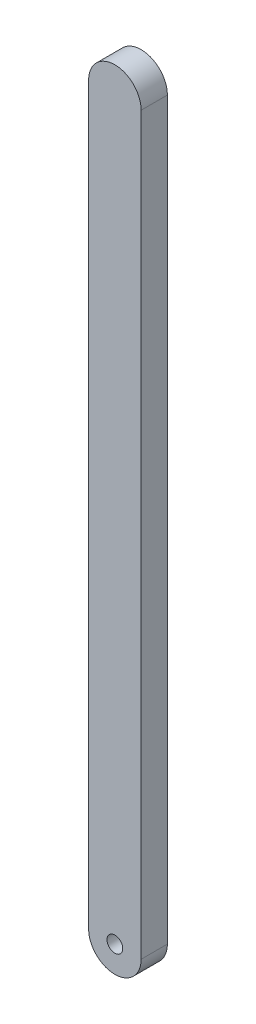
from build123d import *

# Parameters (mm, degrees)
ESQUISSE1_W             = 10
ESQUISSE1_H             = 150
BOSS_EXTRU_1_DEPTH      = 5
CONG_1_RADIUS           = 5
CONG_1_LENGTH           = 5
CONG_2_RADIUS           = 5
CONG_2_LENGTH           = 5
ESQUISSE2_R             = 2.5
ESQUISSE2_R_2           = 1.5
ENL_V_MAT_EXTRU_1_DEPTH = 76.332595867
ESQUISSE3_R             = 2.5
BOSS_EXTRU_2_DEPTH      = 2.5


with BuildPart() as part:
    # Esquisse1 → Boss.-Extru.1 (new body)
    with BuildSketch(Plane.XY):
        Rectangle(ESQUISSE1_W, ESQUISSE1_H)
    extrude(amount=BOSS_EXTRU_1_DEPTH)

    # Congé1: full round fillet: the end face becomes a half cylinder, R = half its width
    cong_1_face = Plane((0, 75, 2.5), x_dir=(0, 0, 1), z_dir=(0, 1, 0))  # on the end face: x along it, z out of the body
    cong_1_slab = cong_1_face.offset(-CONG_1_RADIUS / 2) * Box(CONG_1_LENGTH, 2 * CONG_1_RADIUS, CONG_1_RADIUS, mode=Mode.PRIVATE)  # the body's end, R deep
    cong_1_round = Plane((0, 70, 2.5), x_dir=(0, 1, 0), z_dir=(0, 0, 1)) * Cylinder(CONG_1_RADIUS, CONG_1_LENGTH, mode=Mode.PRIVATE)  # its axis R under the face
    add(cong_1_slab - cong_1_round, mode=Mode.SUBTRACT)

    # Congé2: full round fillet: the end face becomes a half cylinder, R = half its width
    cong_2_face = Plane((0, -75, 2.5), x_dir=(0, 0, 1), z_dir=(0, -1, 0))  # on the end face: x along it, z out of the body
    cong_2_slab = cong_2_face.offset(-CONG_2_RADIUS / 2) * Box(CONG_2_LENGTH, 2 * CONG_2_RADIUS, CONG_2_RADIUS, mode=Mode.PRIVATE)  # the body's end, R deep
    cong_2_round = Plane((0, -70, 2.5), x_dir=(0, -1, 0), z_dir=(0, 0, 1)) * Cylinder(CONG_2_RADIUS, CONG_2_LENGTH, mode=Mode.PRIVATE)  # its axis R under the face
    add(cong_2_slab - cong_2_round, mode=Mode.SUBTRACT)

    # Esquisse2 → Enlèv. mat.-Extru.1 (cut, through all)
    with BuildSketch(Plane.XY.offset(5)):
        with Locations((0, 70)):
            Circle(ESQUISSE2_R)
        with Locations((0, -70)):
            Circle(ESQUISSE2_R_2)
    extrude(amount=-ENL_V_MAT_EXTRU_1_DEPTH, mode=Mode.SUBTRACT)

    # Esquisse3 → Boss.-Extru.2 (add)
    with BuildSketch(Plane.XY.offset(5)):
        with Locations((0, 70)):
            Circle(ESQUISSE3_R)
    extrude(amount=-BOSS_EXTRU_2_DEPTH)


solid = part.part
